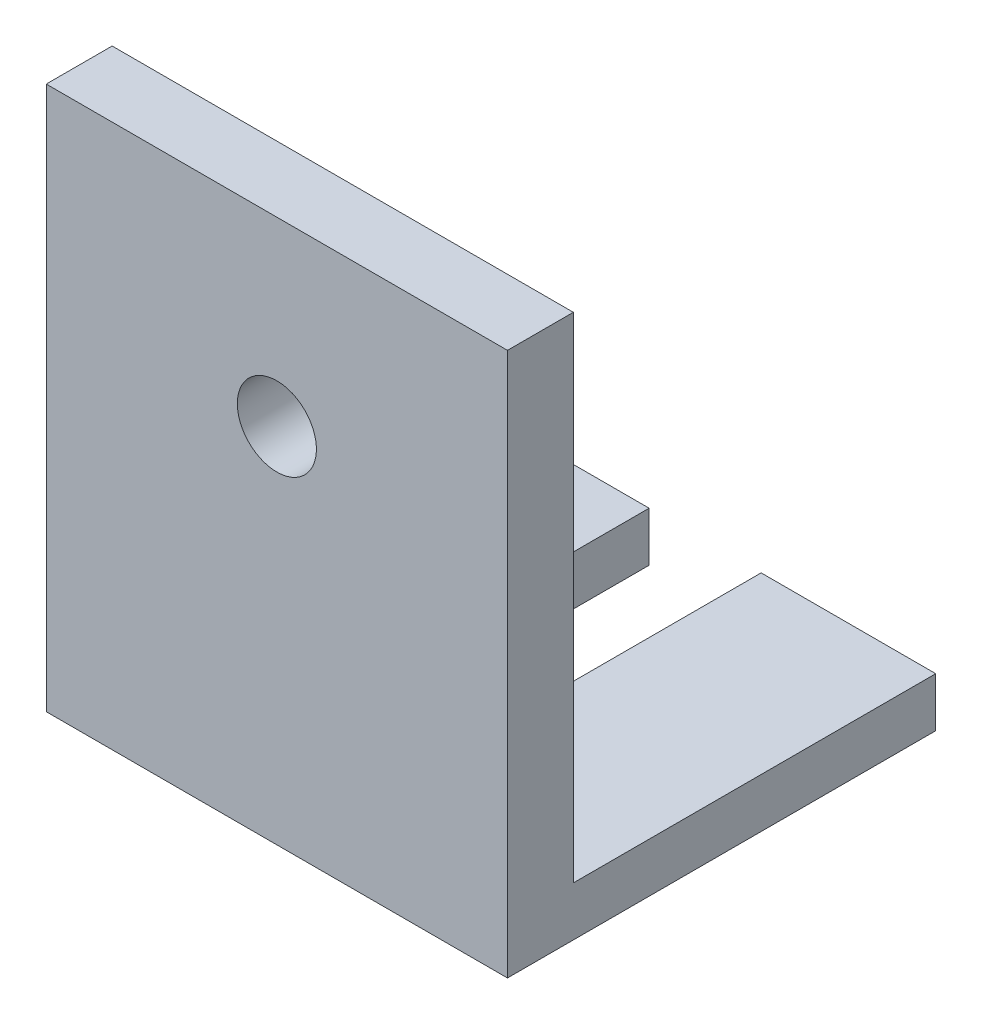
from build123d import *

# Parameters (mm, degrees)
SKETCH1_W           = 28
SKETCH1_H           = 28
BOSS_EXTRUDE1_DEPTH = 25
SKETCH2_W           = 28
SKETCH2_H           = 22
CUT_EXTRUDE1_DEPTH  = 22
SKETCH3_W           = 6.8
SKETCH3_H           = 22
CUT_EXTRUDE2_DEPTH  = 46.299006612
SKETCH4_R           = 2.4
CUT_EXTRUDE3_DEPTH  = 44.508619836
SKETCH5_W           = 28
SKETCH5_H           = 6
CUT_EXTRUDE4_DEPTH  = 4
SKETCH6_W           = 2
SKETCH6_H           = 21
CUT_EXTRUDE5_DEPTH  = 45.821869662
SKETCH7_W           = 28
SKETCH7_H           = 26
BOSS_EXTRUDE2_DEPTH = 12
SKETCH9_W           = 6.8
SKETCH9_H           = 22
CUT_EXTRUDE6_DEPTH  = 12
SKETCH10_W          = 28
SKETCH10_H          = 22
CUT_EXTRUDE7_DEPTH  = 12


with BuildPart() as part:
    # Sketch1 → Boss-Extrude1 (new body)
    with BuildSketch(Plane(origin=(0, 0, 0), x_dir=(1, 0, 0), z_dir=(0, 1, 0))):
        with Locations((14, -14)):
            Rectangle(SKETCH1_W, SKETCH1_H)
    extrude(amount=BOSS_EXTRUDE1_DEPTH)

    # Sketch2 → Cut-Extrude1 (cut)
    with BuildSketch(Plane(origin=(0, 25, 0), x_dir=(1, 0, 0), z_dir=(0, 1, 0))):
        with Locations((14, -11)):
            Rectangle(SKETCH2_W, SKETCH2_H)
    extrude(amount=-CUT_EXTRUDE1_DEPTH, mode=Mode.SUBTRACT)

    # Sketch3 → Cut-Extrude2 (cut, through all)
    with BuildSketch(Plane(origin=(0, 3, 0), x_dir=(1, 0, 0), z_dir=(0, 1, 0))):
        with Locations((14, -11)):
            Rectangle(SKETCH3_W, SKETCH3_H)
    extrude(amount=-CUT_EXTRUDE2_DEPTH, mode=Mode.SUBTRACT)

    # Sketch4 → Cut-Extrude3 (cut, through all)
    with BuildSketch(Plane(origin=(0, 0, 22), x_dir=(-1, 0, 0), z_dir=(0, 0, -1))):
        with Locations((-14, 10)):
            Circle(SKETCH4_R)
    extrude(amount=-CUT_EXTRUDE3_DEPTH, mode=Mode.SUBTRACT)

    # Sketch5 → Cut-Extrude4 (cut)
    with BuildSketch(Plane(origin=(0, 25, 0), x_dir=(1, 0, 0), z_dir=(0, 1, 0))):
        with Locations((14, -25)):
            Rectangle(SKETCH5_W, SKETCH5_H)
    extrude(amount=-CUT_EXTRUDE4_DEPTH, mode=Mode.SUBTRACT)

    # Sketch6 → Cut-Extrude5 (cut, through all)
    with BuildSketch(Plane(origin=(28, 0, 0), x_dir=(0, 0, -1), z_dir=(1, 0, 0))):
        with Locations((-27, 10.5)):
            Rectangle(SKETCH6_W, SKETCH6_H)
    extrude(amount=-CUT_EXTRUDE5_DEPTH, mode=Mode.SUBTRACT)

    # Sketch7 → Boss-Extrude2 (add)
    with BuildSketch(Plane.XZ):
        with Locations((14, 13)):
            Rectangle(SKETCH7_W, SKETCH7_H)
    extrude(amount=BOSS_EXTRUDE2_DEPTH)

    # Sketch9 → Cut-Extrude6 (cut)
    with BuildSketch(Plane(origin=(0, 0, 0), x_dir=(1, 0, 0), z_dir=(0, 1, 0))):
        with Locations((14, -11)):
            Rectangle(SKETCH9_W, SKETCH9_H)
    extrude(amount=-CUT_EXTRUDE6_DEPTH, mode=Mode.SUBTRACT)

    # Sketch10 → Cut-Extrude7 (cut)
    with BuildSketch(Plane(origin=(0, 3, 0), x_dir=(1, 0, 0), z_dir=(0, 1, 0))):
        with Locations((14, -11)):
            Rectangle(SKETCH10_W, SKETCH10_H)
    extrude(amount=-CUT_EXTRUDE7_DEPTH, mode=Mode.SUBTRACT)


solid = part.part
